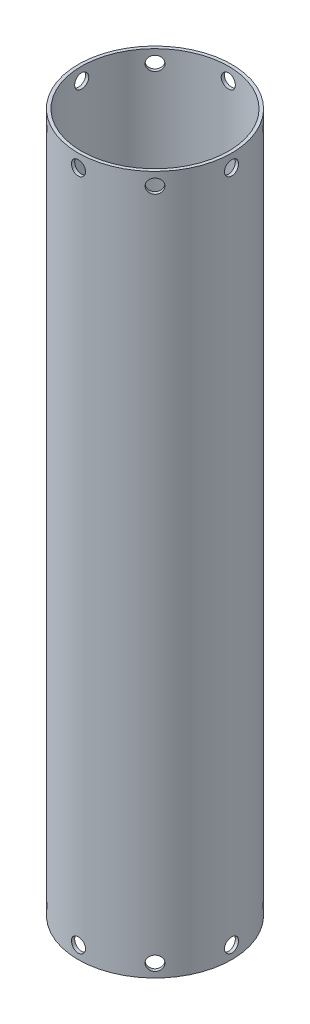
from build123d import *

# Parameters (mm, degrees)
SKETCH1_R                   = 76.2
SKETCH1_R_2                 = 73.025
BOSS_EXTRUDE1_DEPTH         = 693.1406
LOX_TOP_HOLES_REACH         = 678.38
LOX_TOP_HOLES_END_RADIUS    = 76.2
SKETCH2_R                   = 6.985
CIRPATTERN1_COUNT           = 8
LOX_BOTTOM_HOLES_REACH      = 678.38
LOX_BOTTOM_HOLES_END_RADIUS = 76.2
SKETCH3_R                   = 6.985
CIRPATTERN2_COUNT           = 8


with BuildPart() as part:
    # Sketch1 → Boss-Extrude1 (new body)
    with BuildSketch(Plane(origin=(0, 0, 0), x_dir=(1, 0, 0), z_dir=(0, 1, 0))):
        with Locations(Location((0, 0, 0), (0, 0, 270))):
            Circle(SKETCH1_R)
        with Locations(Location((0, 0, 0), (0, 0, 270))):
            Circle(SKETCH1_R_2, mode=Mode.SUBTRACT)
    extrude(amount=BOSS_EXTRUDE1_DEPTH)

    # LOX Top Holes: up to this cylinder (the profile starts inside it)
    lox_top_holes_end = Plane(origin=(0, 680.4406, 0), z_dir=(0, -1, 0)) * Cylinder(LOX_TOP_HOLES_END_RADIUS, 1510.16, mode=Mode.PRIVATE)
    # Sketch2 → LOX Top Holes (cut, up to the surface)
    with BuildSketch(Plane(origin=(0, 667.7406, 0), x_dir=(0, 0, 1), z_dir=(1, 0, 0)), mode=Mode.PRIVATE) as lox_top_holes_sk1:
        with Locations((0, -12.7)):
            Circle(SKETCH2_R)
    lox_top_holes_tool1 = extrude(lox_top_holes_sk1.sketch, amount=LOX_TOP_HOLES_REACH, mode=Mode.PRIVATE) & lox_top_holes_end
    lox_top_holes = lox_top_holes_tool1.solids().sort_by_distance((0, 680.4406, 0))[0]
    add(lox_top_holes, mode=Mode.SUBTRACT)

    # CirPattern1: LOX Top Holes ×8 about axis
    cirpattern1_axis = Axis((0, 693.1406, 0), (0, 1, 0))
    for i in range(1, CIRPATTERN1_COUNT):
        add(lox_top_holes.rotate(cirpattern1_axis, i * 360 / CIRPATTERN1_COUNT), mode=Mode.SUBTRACT)

    # LOX Bottom Holes: up to this cylinder (the profile starts inside it)
    lox_bottom_holes_end = Plane(origin=(0, 12.7, 0), z_dir=(0, -1, 0)) * Cylinder(LOX_BOTTOM_HOLES_END_RADIUS, 1510.16, mode=Mode.PRIVATE)
    # Sketch3 → LOX Bottom Holes (cut, up to the surface)
    with BuildSketch(Plane(origin=(0, 25.4, 0), x_dir=(0, 0, -1), z_dir=(1, 0, 0)), mode=Mode.PRIVATE) as lox_bottom_holes_sk1:
        with Locations(Location((0, -12.7, 0), (0, 0, 180))):
            Circle(SKETCH3_R)
    lox_bottom_holes_tool1 = extrude(lox_bottom_holes_sk1.sketch, amount=LOX_BOTTOM_HOLES_REACH, mode=Mode.PRIVATE) & lox_bottom_holes_end
    lox_bottom_holes = lox_bottom_holes_tool1.solids().sort_by_distance((0, 12.7, 0))[0]
    add(lox_bottom_holes, mode=Mode.SUBTRACT)

    # CirPattern2: LOX Bottom Holes ×8 about axis
    cirpattern2_axis = Axis((0, 0, 0), (0, 1, 0))
    for i in range(1, CIRPATTERN2_COUNT):
        add(lox_bottom_holes.rotate(cirpattern2_axis, i * 360 / CIRPATTERN2_COUNT), mode=Mode.SUBTRACT)


solid = part.part
